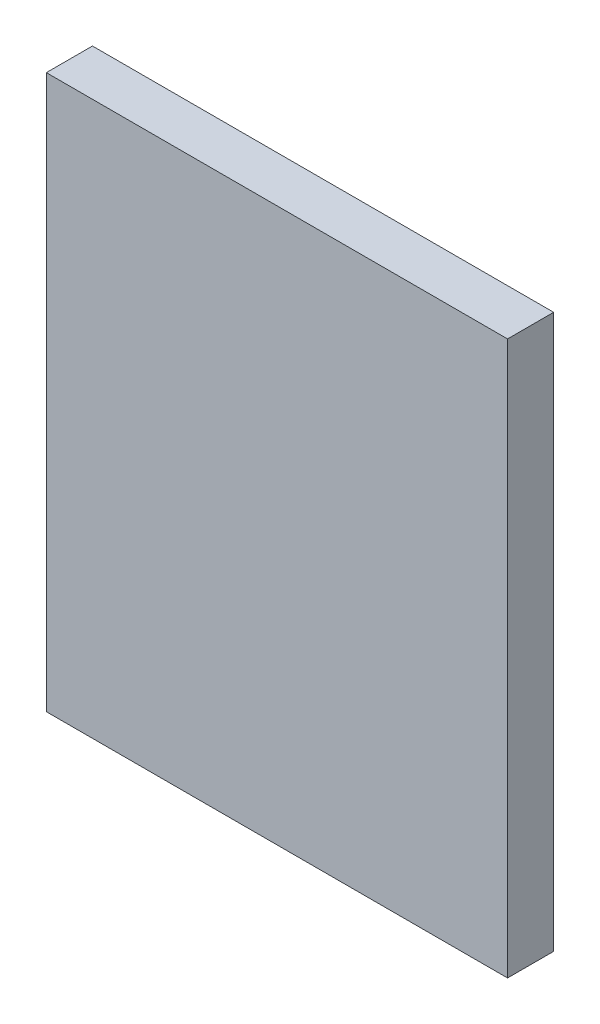
from build123d import *

# Parameters (mm, degrees)
SKETCH1_W           = 254
SKETCH1_H           = 25.4
BOSS_EXTRUDE1_DEPTH = 304.8


with BuildPart() as part:
    # Sketch1 → Boss-Extrude1 (new body)
    with BuildSketch(Plane(origin=(0, 0, 0), x_dir=(1, 0, 0), z_dir=(0, 1, 0))):
        Rectangle(SKETCH1_W, SKETCH1_H)
    extrude(amount=BOSS_EXTRUDE1_DEPTH)


solid = part.part
